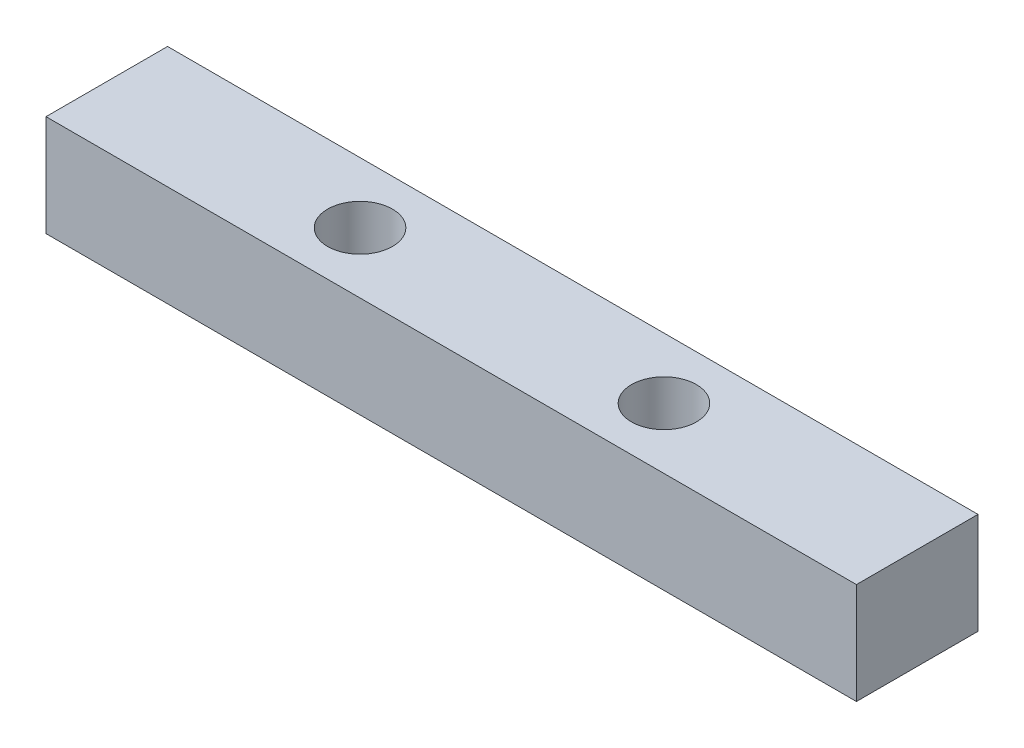
from build123d import *

# Parameters (mm, degrees)
SKETCH_1_W      = 40
SKETCH_1_H      = 6
SKETCH_1_R      = 1.6
EXTRUDE_1_DEPTH = 5


with BuildPart() as part:
    # 草图1 → 凸台-拉伸1 (new body)
    with BuildSketch(Plane(origin=(0, 0, 0), x_dir=(1, 0, 0), z_dir=(0, 1, 0))):
        Rectangle(SKETCH_1_W, SKETCH_1_H)
        with Locations(Location((-7.5, 0, 0), (0, 0, 270))):
            Circle(SKETCH_1_R, mode=Mode.SUBTRACT)
        with Locations(Location((7.5, 0, 0), (0, 0, 90))):
            Circle(SKETCH_1_R, mode=Mode.SUBTRACT)
    extrude(amount=EXTRUDE_1_DEPTH)


solid = part.part
